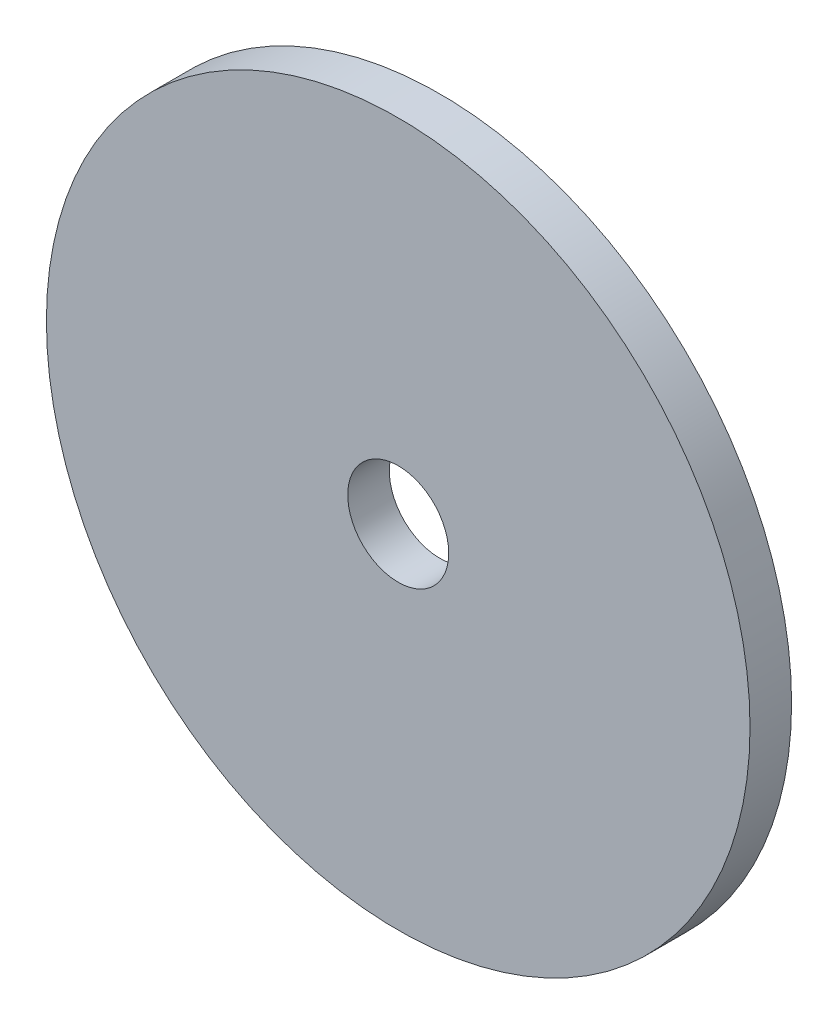
from build123d import *

# Parameters (mm, degrees)
SKETCH1_R           = 25.4
BOSS_EXTRUDE1_DEPTH = 3
SKETCH2_R           = 3.6449
CUT_EXTRUDE1_DEPTH  = 37.046081618


with BuildPart() as part:
    # Sketch1 → Boss-Extrude1 (new body)
    with BuildSketch(Plane.XY):
        Circle(SKETCH1_R)
    extrude(amount=BOSS_EXTRUDE1_DEPTH)

    # Sketch2 → Cut-Extrude1 (cut, through all)
    with BuildSketch(Plane.XY.offset(3)):
        Circle(SKETCH2_R)
    extrude(amount=-CUT_EXTRUDE1_DEPTH, mode=Mode.SUBTRACT)


solid = part.part
